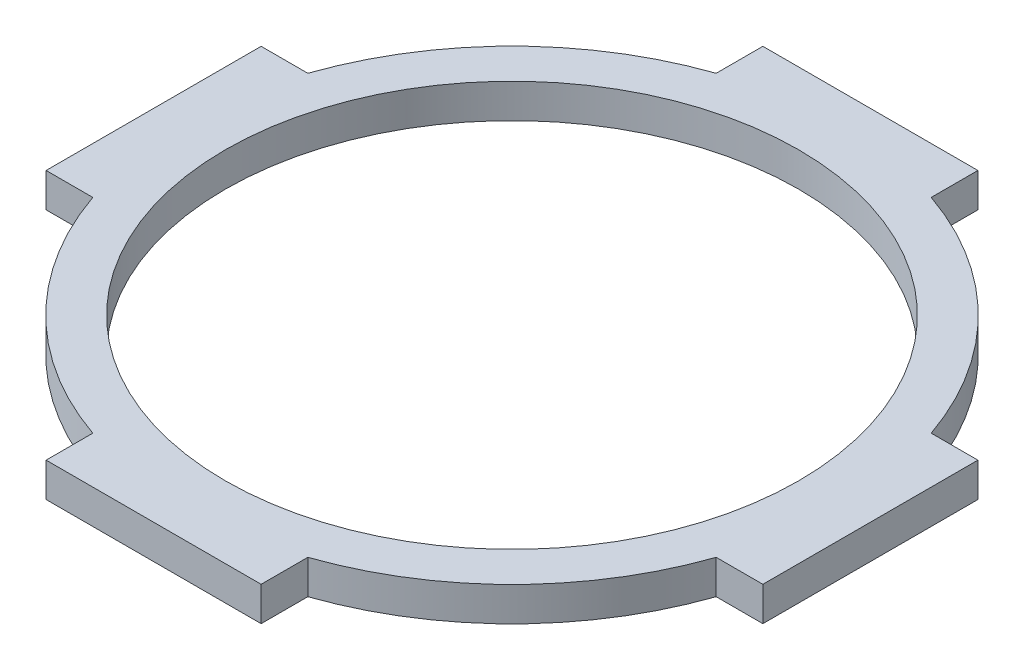
from build123d import *

# Parameters (mm, degrees)
SKETCH1_R           = 46
SKETCH1_R_2         = 40
BOSS_EXTRUDE1_DEPTH = 4.7625
BOSS_EXTRUDE2_START = -4.7625
BOSS_EXTRUDE2_DEPTH = 4.7625
CIRPATTERN1_COUNT   = 4


with BuildPart() as part:
    # Sketch1 → Boss-Extrude1 (new body)
    with BuildSketch(Plane(origin=(0, 0, 0), x_dir=(1, 0, 0), z_dir=(0, 1, 0))):
        with Locations(Location((0, 0, 0), (0, 0, 90))):
            Circle(SKETCH1_R)
        with Locations(Location((0, 0, 0), (0, 0, 90))):
            Circle(SKETCH1_R_2, mode=Mode.SUBTRACT)
    extrude(amount=BOSS_EXTRUDE1_DEPTH)

    # Sketch2 → Boss-Extrude2 (add)
    with BuildSketch(Plane(origin=(0, 4.7625, 0), x_dir=(1, 0, 0), z_dir=(0, 1, 0)).offset(BOSS_EXTRUDE2_START)):
        with BuildLine():
            Line((-43.48562981, 15), (-50, 15))
            Line((-50, 15), (-50, -15))
            Line((-50, -15), (-43.48562981, -15))
            ThreePointArc((-43.48562981, -15), (-46, 0), (-43.48562981, 15))
        make_face()
    boss_extrude2 = extrude(amount=BOSS_EXTRUDE2_DEPTH)

    # CirPattern1: Boss-Extrude2 ×4 about axis
    cirpattern1_axis = Axis((0, 0, 0), (0, 1, 0))
    for i in range(1, CIRPATTERN1_COUNT):
        add(boss_extrude2.rotate(cirpattern1_axis, i * 360 / CIRPATTERN1_COUNT))


solid = part.part
